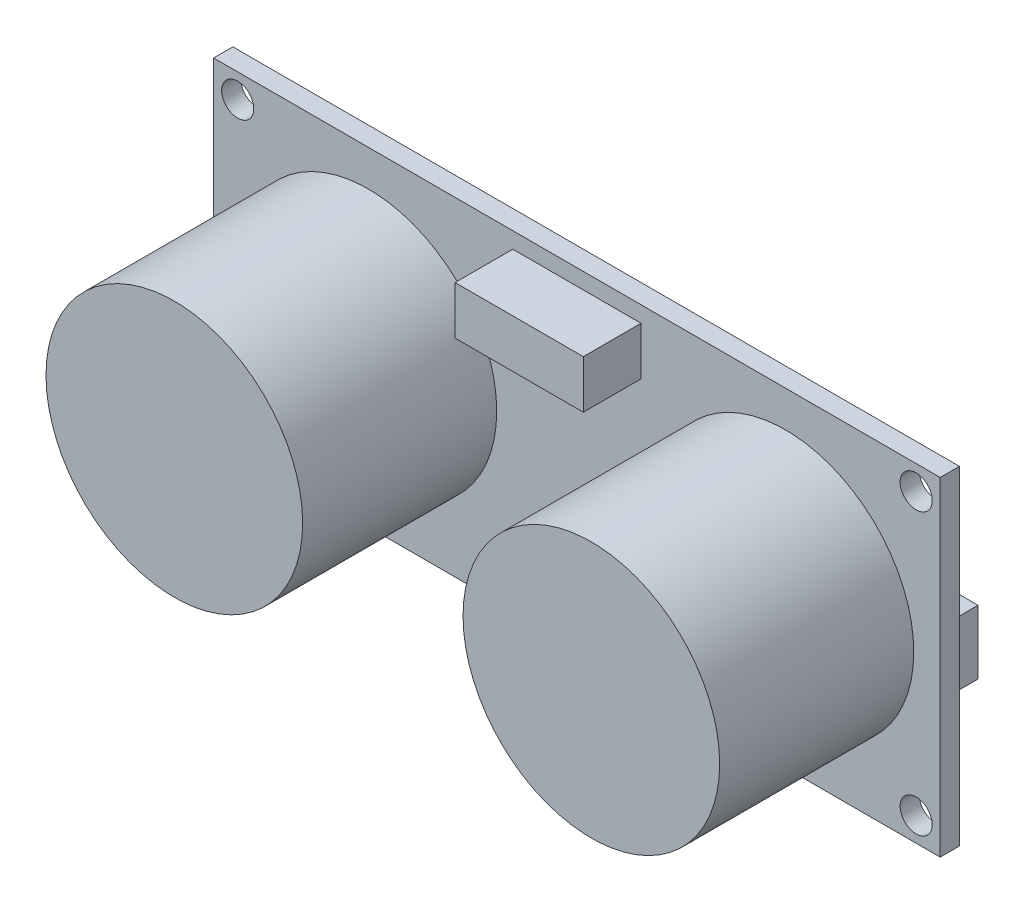
from build123d import *

# Parameters (mm, degrees)
SKETCH_1_W          = 45.3
SKETCH_1_H          = 20.5
SKETCH_1_R          = 8
SKETCH_1_R_2        = 1
EXTRUDE_1_DEPTH     = 1.2
EXTRUDE_START       = -1.2
SKETCH_2_R          = 8
EXTRUDE_2_DEPTH     = 13.3
SKETCH_3_W          = 8
SKETCH_3_H          = 3
EXTRUDE_3_DEPTH     = 4.8
SKETCH_5_W          = 7.748347941
SKETCH_5_H          = 3.984864655
SKETCH_5_W_2        = 9.563675173
SKETCH_5_H_2        = 6.597164818
SKETCH_5_W_3        = 5.313152873
SKETCH_5_H_3        = 11.201897308
EXTRUDE_4_DEPTH     = 3
CUT_EXTRUDE_1_REACH = 30.195
SKETCH_6_R          = 1.27


with BuildPart() as part:
    # 草图1 → 凸台-拉伸1 (new body)
    with BuildSketch(Plane.XY):
        Rectangle(SKETCH_1_W, SKETCH_1_H)
        with Locations((-13, 0)):
            Circle(SKETCH_1_R, mode=Mode.SUBTRACT)
        with Locations((13, 0)):
            Circle(SKETCH_1_R, mode=Mode.SUBTRACT)
        with Locations((-21.15, 8.75)):
            Circle(SKETCH_1_R_2, mode=Mode.SUBTRACT)
        with Locations(Location((21.15, 8.75, 0), (0, 0, 180))):
            Circle(SKETCH_1_R_2, mode=Mode.SUBTRACT)
        with Locations(Location((-21.15, -8.75, 0), (0, 0, 180))):
            Circle(SKETCH_1_R_2, mode=Mode.SUBTRACT)
        with Locations((21.15, -8.75)):
            Circle(SKETCH_1_R_2, mode=Mode.SUBTRACT)
    extrude(amount=EXTRUDE_1_DEPTH)

    # 草图2 → 凸台-拉伸2 (add)
    with BuildSketch(Plane.XY.offset(1.2).offset(EXTRUDE_START)):
        with Locations((13, 0)):
            Circle(SKETCH_2_R)
        with Locations((-13, 0)):
            Circle(SKETCH_2_R)
    extrude(amount=EXTRUDE_2_DEPTH)

    # 草图3 → 凸台-拉伸3 (add)
    with BuildSketch(Plane.XY.offset(1.2).offset(EXTRUDE_START)):
        with Locations((0, 7.75)):
            Rectangle(SKETCH_3_W, SKETCH_3_H)
    extrude(amount=EXTRUDE_3_DEPTH)

    # 草图5 → 凸台-拉伸4 (add)
    with BuildSketch(Plane(origin=(0, 0, 0), x_dir=(-1, 0, 0), z_dir=(0, 0, -1)).offset(EXTRUDE_START)):
        with Locations((-18.131134181, -0.464900877)):
            Rectangle(SKETCH_5_W, SKETCH_5_H)
        with Locations((-0.398486465, 0.841249205)):
            Rectangle(SKETCH_5_W_2, SKETCH_5_H_2)
        with Locations((18.950245248, 0.309933918)):
            Rectangle(SKETCH_5_W_3, SKETCH_5_H_3)
    extrude(amount=EXTRUDE_4_DEPTH)

    # 草图6 → 切除-拉伸1 (cut, up to next)
    with BuildSketch(Plane(origin=(0, 0, 0), x_dir=(-1, 0, 0), z_dir=(0, 0, -1)), mode=Mode.PRIVATE) as cut_extrude_1_sk1:
        with Locations((-4.031891603, -8.25)):
            Circle(SKETCH_6_R)
    cut_extrude_1_tool1 = extrude(cut_extrude_1_sk1.sketch, amount=-CUT_EXTRUDE_1_REACH, mode=Mode.PRIVATE) & part.part
    add(cut_extrude_1_tool1.solids().sort_by_distance((4.031892, -8.25, 0))[0], mode=Mode.SUBTRACT)


solid = part.part
